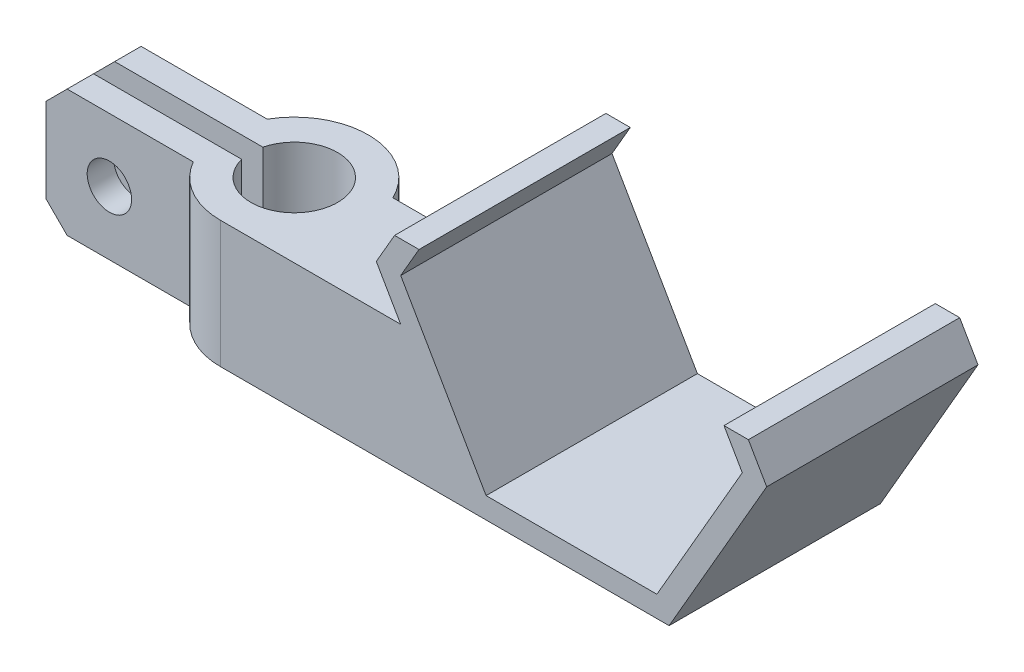
from build123d import *

# Parameters (mm, degrees)
P_IDAT_VYSUNUT_M1_DEPTH  = 20
P_IDAT_VYSUNUT_M2_DEPTH  = 10
P_IDAT_START             = -16
P_IDAT_VYSUNUT_M3_DEPTH  = 12
ODEBRAT_START            = -4
SKICA4_R                 = 4.1
ODEBRAT_VYSUNUT_M1_DEPTH = 56.078274453
ODEBRAT_VYSUNUT_M5_REACH = 59.987
SKICA11_R                = 2.1
ODEBRAT_VYSUNUT_M6_REACH = 58.573
SKICA12_R                = 2.8
ZKOSEN_2_SIZE            = 2
P_IDAT_START_2           = 1
SKICA13_R                = 4.5
SKICA13_R_2              = 2.8
P_IDAT_VYSUNUT_M5_DEPTH  = 1


with BuildPart() as part:
    # Skica1 → Přidat vysunutím1 (new body)
    with BuildSketch(Plane.XY):
        Polygon((-14.43375673, 3), (-16.165807537, 0), (-8.082903769, -14), (8.082903769, -14), (16.165807537, 0), (14.43375673, 3), (16.743157806, 3), (18.475208614, 0), (9.237604307, -16), (-9.237604307, -16), (-18.475208614, 0), (-16.743157806, 3), align=None)
    extrude(amount=P_IDAT_VYSUNUT_M1_DEPTH)

    # Skica2 → Přidat vysunutím2 (add)
    with BuildSketch(Plane.XY.offset(10)):
        Polygon((-9.237604307, -16), (-29.237604307, -16), (-29.237604307, -4), (-16.165807537, -4), align=None)
    extrude(amount=P_IDAT_VYSUNUT_M2_DEPTH)

    # Skica3 → Přidat vysunutím3 (add)
    with BuildSketch(Plane(origin=(0, 0, 0), x_dir=(1, 0, 0), z_dir=(0, 1, 0)).offset(P_IDAT_START)):
        with BuildLine():
            Line((-29.237604307, -12.1), (-29.237604307, -10))
            Line((-29.237604307, -10), (-26.913048987, -10))
            ThreePointArc((-26.913048987, -10), (-32.955273849, -6.005695924), (-39.299782134, -9.5))
            Line((-39.299782134, -9.5), (-53.237604307, -9.5))
            Line((-53.237604307, -9.5), (-53.237604307, -12))
            Line((-53.237604307, -12), (-37.213783377, -12))
            ThreePointArc((-37.213783377, -12), (-33.186205288, -8.900322191), (-29.237604307, -12.1))
        make_face()
        with BuildLine():
            Line((-53.237604307, -14), (-53.237604307, -16.5))
            Line((-53.237604307, -16.5), (-39.299782134, -16.5))
            ThreePointArc((-39.299782134, -16.5), (-36.737604307, -19.062177826), (-33.237604307, -20))
            Line((-33.237604307, -20), (-29.237604307, -20))
            Line((-29.237604307, -20), (-29.237604307, -13.9))
            ThreePointArc((-29.237604307, -13.9), (-33.186205288, -17.099677809), (-37.213783377, -14))
            Line((-37.213783377, -14), (-53.237604307, -14))
        make_face()
    extrude(amount=P_IDAT_VYSUNUT_M3_DEPTH)

    # Skica4 → Odebrat vysunutím1 (cut, through all)
    with BuildSketch(Plane(origin=(0, 0, 0), x_dir=(1, 0, 0), z_dir=(0, 1, 0)).offset(ODEBRAT_START)):
        with Locations((-33.237604307, -13)):
            Circle(SKICA4_R)
    extrude(amount=-ODEBRAT_VYSUNUT_M1_DEPTH, mode=Mode.SUBTRACT)

    # Skica11 → Odebrat vysunutím5 (cut, up to next)
    with BuildSketch(Plane.XY.offset(16.5), mode=Mode.PRIVATE) as odebrat_vysunut_m5_sk1:
        with Locations((-47.237604307, -10)):
            Circle(SKICA11_R)
    odebrat_vysunut_m5_tool1 = extrude(odebrat_vysunut_m5_sk1.sketch, amount=-ODEBRAT_VYSUNUT_M5_REACH, mode=Mode.PRIVATE) & part.part
    add(odebrat_vysunut_m5_tool1.solids().sort_by_distance((-47.237604, -10, 16.5))[0], mode=Mode.SUBTRACT)

    # Skica12 → Odebrat vysunutím6 (cut, up to next)
    with BuildSketch(Plane(origin=(0, 0, 9.5), x_dir=(-1, 0, 0), z_dir=(0, 0, -1)), mode=Mode.PRIVATE) as odebrat_vysunut_m6_sk1:
        with Locations((47.237604307, -10)):
            Circle(SKICA12_R)
    odebrat_vysunut_m6_tool1 = extrude(odebrat_vysunut_m6_sk1.sketch, amount=-ODEBRAT_VYSUNUT_M6_REACH, mode=Mode.PRIVATE) & part.part
    add(odebrat_vysunut_m6_tool1.solids().sort_by_distance((-47.237604, -10, 9.5))[0], mode=Mode.SUBTRACT)

    # Zkosení2
    zkosen_2_edges = [part.edges().sort_by_distance(p)[0] for p in [
        (-53.237604307, -4, 10.75),
        (-53.237604307, -16, 10.75),
        (-53.237604307, -4, 15.25),
        (-53.237604307, -16, 15.25),
    ]]
    chamfer(zkosen_2_edges, length=ZKOSEN_2_SIZE)

    # Skica13 → Přidat vysunutím5 (add)
    with BuildSketch(Plane(origin=(0, 0, 9.5), x_dir=(-1, 0, 0), z_dir=(0, 0, -1)).offset(P_IDAT_START_2)):
        with Locations((47.237604307, -10)):
            Circle(SKICA13_R)
        with Locations((47.237604307, -10)):
            Circle(SKICA13_R_2, mode=Mode.SUBTRACT)
    extrude(amount=-P_IDAT_VYSUNUT_M5_DEPTH)


solid = part.part
